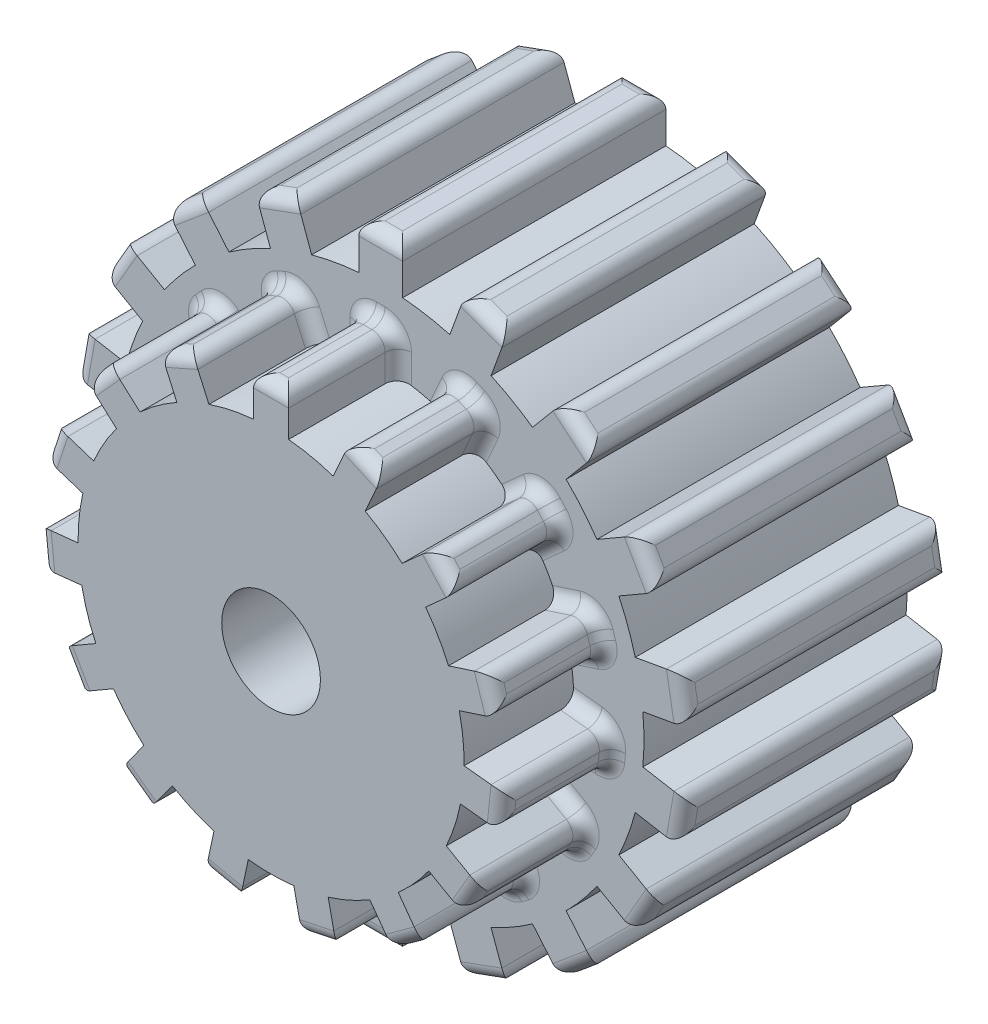
from build123d import *

# Parameters (mm, degrees)
SKETCH2_R                = 60
BOSS_EXTRUDE1_DEPTH      = 60
SKETCH3_W                = 10
SKETCH3_H                = 10.47851478
BOSS_EXTRUDE2_DEPTH      = 60
FILLET2_R                = 3
CIRPATTERN1_COUNT        = 18
FILLET2_OF_CIRPATTERN1_R = 3
SKETCH4_R                = 10
CUT_EXTRUDE1_DEPTH       = 60
SKETCH5_R                = 44
BOSS_EXTRUDE3_DEPTH      = 25
SKETCH6_W                = 8
SKETCH6_H                = 10.044359629
BOSS_EXTRUDE4_DEPTH      = 25
CUT_EXTRUDE2_START       = -90
SKETCH7_R                = 10
CUT_EXTRUDE2_DEPTH       = 90
FILLET3_R                = 3
CIRPATTERN2_COUNT        = 15
FILLET3_OF_CIRPATTERN2_R = 3
SKETCH8_R                = 11.25
CUT_EXTRUDE3_DEPTH       = 85


with BuildPart() as part:
    # Sketch2 → Boss-Extrude1 (new body)
    with BuildSketch(Plane.XY):
        Circle(SKETCH2_R)
    extrude(amount=BOSS_EXTRUDE1_DEPTH)

    # Sketch3 → Boss-Extrude2 (add)
    with BuildSketch(Plane.XY.offset(60)):
        with Locations((0, 64.76074261)):
            Rectangle(SKETCH3_W, SKETCH3_H)
    boss_extrude2 = extrude(amount=-BOSS_EXTRUDE2_DEPTH)

    # Fillet2
    fillet2_edges = [part.edges().sort_by_distance(p)[0] for p in [
        (5, 70, 30),
        (0, 70, 0),
        (-5, 70, 30),
        (0, 70, 60),
    ]]
    fillet(fillet2_edges, radius=FILLET2_R)

    # CirPattern1: Boss-Extrude2 ×18 about axis
    cirpattern1_axis = Axis((0, 0, 0), (0, 0, 1))
    for i in range(1, CIRPATTERN1_COUNT):
        add(boss_extrude2.rotate(cirpattern1_axis, i * 360 / CIRPATTERN1_COUNT))

    # Fillet2 of CirPattern1
    fillet2_of_cirpattern1_edges = [part.edges().sort_by_distance(p)[0] for p in [
        (-19.242946929, 67.488584172, 30),
        (-23.941410033, 65.778483455, 0),
        (-28.639873137, 64.068382738, 30),
        (-23.941410033, 65.778483455, 60),
        (-41.164910462, 56.837049067, 30),
        (-44.995132678, 53.623111018, 0),
        (-48.825354894, 50.40917297, 30),
        (-44.995132678, 53.623111018, 60),
        (-58.121778265, 39.330127019, 30),
        (-60.621778265, 35, 0),
        (-63.121778265, 30.669872981, 30),
        (-60.621778265, 35, 60),
        (-68.068301823, 17.079411202, 30),
        (-68.936542711, 12.155372437, 0),
        (-69.804783599, 7.231333672, 30),
        (-68.936542711, 12.155372437, 60),
        (-69.804783599, -7.231333672, 30),
        (-68.936542711, -12.155372437, 0),
        (-68.068301823, -17.079411202, 30),
        (-68.936542711, -12.155372437, 60),
        (-63.121778265, -30.669872981, 30),
        (-60.621778265, -35, 0),
        (-58.121778265, -39.330127019, 30),
        (-60.621778265, -35, 60),
        (-48.825354894, -50.40917297, 30),
        (-44.995132678, -53.623111018, 0),
        (-41.164910462, -56.837049067, 30),
        (-44.995132678, -53.623111018, 60),
        (-28.639873137, -64.068382738, 30),
        (-23.941410033, -65.778483455, 0),
        (-19.242946929, -67.488584172, 30),
        (-23.941410033, -65.778483455, 60),
        (-5, -70, 30),
        (0, -70, 0),
        (5, -70, 30),
        (0, -70, 60),
        (19.242946929, -67.488584172, 30),
        (23.941410033, -65.778483455, 0),
        (28.639873137, -64.068382738, 30),
        (23.941410033, -65.778483455, 60),
        (41.164910462, -56.837049067, 30),
        (44.995132678, -53.623111018, 0),
        (48.825354894, -50.40917297, 30),
        (44.995132678, -53.623111018, 60),
        (58.121778265, -39.330127019, 30),
        (60.621778265, -35, 0),
        (63.121778265, -30.669872981, 30),
        (60.621778265, -35, 60),
        (68.068301823, -17.079411202, 30),
        (68.936542711, -12.155372437, 0),
        (69.804783599, -7.231333672, 30),
        (68.936542711, -12.155372437, 60),
        (69.804783599, 7.231333672, 30),
        (68.936542711, 12.155372437, 0),
        (68.068301823, 17.079411202, 30),
        (68.936542711, 12.155372437, 60),
        (63.121778265, 30.669872981, 30),
        (60.621778265, 35, 0),
        (58.121778265, 39.330127019, 30),
        (60.621778265, 35, 60),
        (48.825354894, 50.40917297, 30),
        (44.995132678, 53.623111018, 0),
        (41.164910462, 56.837049067, 30),
        (44.995132678, 53.623111018, 60),
        (28.639873137, 64.068382738, 30),
        (23.941410033, 65.778483455, 0),
        (19.242946929, 67.488584172, 30),
        (23.941410033, 65.778483455, 60),
    ]]
    fillet(fillet2_of_cirpattern1_edges, radius=FILLET2_OF_CIRPATTERN1_R)

    # Sketch4 → Cut-Extrude1 (cut)
    with BuildSketch(Plane.XY.offset(60)):
        Circle(SKETCH4_R)
    extrude(amount=-CUT_EXTRUDE1_DEPTH, mode=Mode.SUBTRACT)

    # Sketch5 → Boss-Extrude3 (add)
    with BuildSketch(Plane.XY.offset(60)):
        Circle(SKETCH5_R)
    extrude(amount=BOSS_EXTRUDE3_DEPTH)

    # Sketch6 → Boss-Extrude4 (add)
    with BuildSketch(Plane.XY.offset(85)):
        with Locations((0, 47.977820186)):
            Rectangle(SKETCH6_W, SKETCH6_H)
    boss_extrude4 = extrude(amount=-BOSS_EXTRUDE4_DEPTH)

    # Sketch7 → Cut-Extrude2 (cut)
    with BuildSketch(Plane(origin=(0, 0, 0), x_dir=(-1, 0, 0), z_dir=(0, 0, -1)).offset(CUT_EXTRUDE2_START)):
        with Locations(Location((0, 0, 0), (0, 0, 180))):
            Circle(SKETCH7_R)
    extrude(amount=CUT_EXTRUDE2_DEPTH, mode=Mode.SUBTRACT)

    # Fillet3
    fillet3_edges = [part.edges().sort_by_distance(p)[0] for p in [
        (-4, 48.4089023, 60),
        (4, 48.4089023, 60),
        (4, 53, 72.5),
        (0, 53, 60),
        (-4, 53, 72.5),
        (0, 53, 85),
    ]]
    fillet(fillet3_edges, radius=FILLET3_R)

    # CirPattern2: Boss-Extrude4 ×15 about axis
    cirpattern2_axis = Axis((0, 0, 0), (0, 0, 1))
    for i in range(1, CIRPATTERN2_COUNT):
        add(boss_extrude4.rotate(cirpattern2_axis, i * 360 / CIRPATTERN2_COUNT))

    # Fillet3 of CirPattern2
    fillet3_of_cirpattern2_edges = [part.edges().sort_by_distance(p)[0] for p in [
        (-23.343856247, 42.596786234, 60),
        (-16.035492586, 45.850679378, 60),
        (-17.902860252, 50.044855827, 72.5),
        (-21.557042083, 48.417909255, 60),
        (-25.211223914, 46.790962683, 72.5),
        (-21.557042083, 48.417909255, 85),
        (-38.651347677, 29.419298847, 60),
        (-33.298302826, 35.364457451, 60),
        (-36.710153325, 38.436501439, 72.5),
        (-39.38667575, 35.463922137, 60),
        (-42.063198176, 32.491342835, 72.5),
        (-39.38667575, 35.463922137, 85),
        (-47.275669957, 11.154947425, 60),
        (-44.803534002, 18.763399555, 60),
        (-49.169927386, 20.182126767, 72.5),
        (-50.405995364, 16.377900702, 60),
        (-51.642063341, 12.573674637, 72.5),
        (-50.405995364, 16.377900702, 85),
        (-47.725599415, -9.038195747, 60),
        (-48.561827121, -1.082020584, 60),
        (-53.127774308, -1.561920972, 72.5),
        (-52.709660455, -5.540008553, 60),
        (-52.291546601, -9.518096135, 72.5),
        (-52.709660455, -5.540008553, 85),
        (-39.923339161, -27.668552765, 60),
        (-43.923339161, -20.740349535, 60),
        (-47.899346401, -23.035898385, 72.5),
        (-45.899346401, -26.5, 60),
        (-43.899346401, -29.964101615, 72.5),
        (-45.899346401, -26.5, 85),
        (-25.217970874, -41.514765649, 60),
        (-31.690106829, -36.812483631, 60),
        (-34.388686349, -40.526759693, 72.5),
        (-31.152618372, -42.877900702, 60),
        (-27.916550394, -45.229041711, 72.5),
        (-31.152618372, -42.877900702, 85),
        (-6.152186325, -48.182698402, 60),
        (-13.977367131, -46.519404876, 60),
        (-14.931910016, -51.010176076, 72.5),
        (-11.019319613, -51.841822839, 60),
        (-7.10672921, -52.673469602, 72.5),
        (-11.019319613, -51.841822839, 85),
        (13.977367131, -46.519404876, 60),
        (6.152186325, -48.182698402, 60),
        (7.10672921, -52.673469602, 72.5),
        (11.019319613, -51.841822839, 60),
        (14.931910016, -51.010176076, 72.5),
        (11.019319613, -51.841822839, 85),
        (31.690106829, -36.812483631, 60),
        (25.217970874, -41.514765649, 60),
        (27.916550394, -45.229041711, 72.5),
        (31.152618372, -42.877900702, 60),
        (34.388686349, -40.526759693, 72.5),
        (31.152618372, -42.877900702, 85),
        (43.923339161, -20.740349535, 60),
        (39.923339161, -27.668552765, 60),
        (43.899346401, -29.964101615, 72.5),
        (45.899346401, -26.5, 60),
        (47.899346401, -23.035898385, 72.5),
        (45.899346401, -26.5, 85),
        (48.561827121, -1.082020584, 60),
        (47.725599415, -9.038195747, 60),
        (52.291546601, -9.518096135, 72.5),
        (52.709660455, -5.540008553, 60),
        (53.127774308, -1.561920972, 72.5),
        (52.709660455, -5.540008553, 85),
        (44.803534002, 18.763399555, 60),
        (47.275669957, 11.154947425, 60),
        (51.642063341, 12.573674637, 72.5),
        (50.405995364, 16.377900702, 60),
        (49.169927386, 20.182126767, 72.5),
        (50.405995364, 16.377900702, 85),
        (33.298302826, 35.364457451, 60),
        (38.651347677, 29.419298847, 60),
        (42.063198176, 32.491342835, 72.5),
        (39.38667575, 35.463922137, 60),
        (36.710153325, 38.436501439, 72.5),
        (39.38667575, 35.463922137, 85),
        (16.035492586, 45.850679378, 60),
        (23.343856247, 42.596786234, 60),
        (25.211223914, 46.790962683, 72.5),
        (21.557042083, 48.417909255, 60),
        (17.902860252, 50.044855827, 72.5),
        (21.557042083, 48.417909255, 85),
    ]]
    fillet(fillet3_of_cirpattern2_edges, radius=FILLET3_OF_CIRPATTERN2_R)

    # Sketch8 → Cut-Extrude3 (cut)
    with BuildSketch(Plane(origin=(0, 0, 0), x_dir=(-1, 0, 0), z_dir=(0, 0, -1))):
        Circle(SKETCH8_R)
    extrude(amount=-CUT_EXTRUDE3_DEPTH, mode=Mode.SUBTRACT)


solid = part.part
